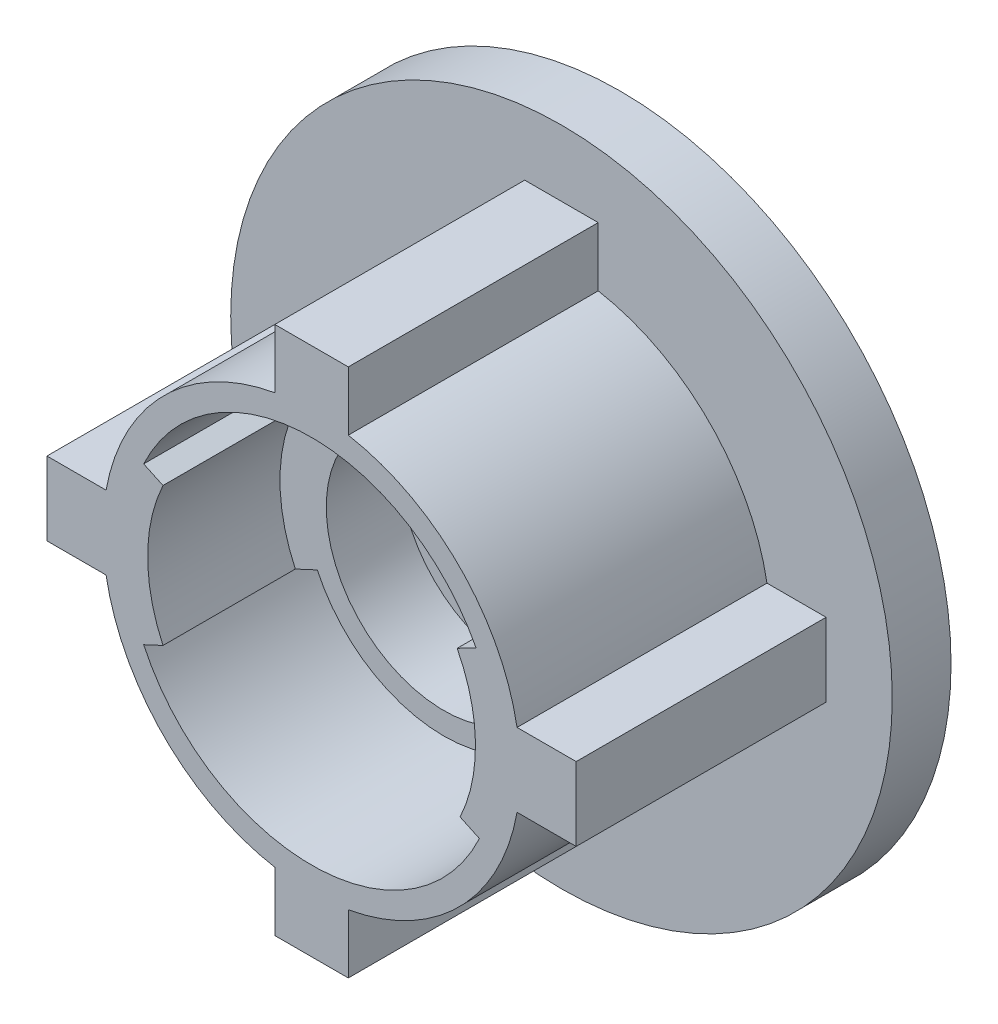
from build123d import *
from build123d.topology import SkipClean

# Parameters (mm, degrees)
ESBO_O1_R                 = 11.15
RESSALTO_EXTRUS_O1_DEPTH  = 15
ESBO_O2_R                 = 22.5
RESSALTO_EXTRUS_O2_DEPTH  = 4
RESSALTO_EXTRUS_O6_START  = -8
ESBO_O5_R                 = 11.15
ESBO_O5_R_2               = 8
RESSALTO_EXTRUS_O6_DEPTH  = 8
RESSALTO_EXTRUS_O7_START  = 4
ESBO_O7_R                 = 14.2
ESBO_O7_R_2               = 11.15
RESSALTO_EXTRUS_O7_DEPTH  = 4
RESSALTO_EXTRUS_O8_START  = 4
ESBO_O8_R                 = 11.15
ESBO_O8_R_2               = 8
RESSALTO_EXTRUS_O8_DEPTH  = 4
CORTE_EXTRUS_O1_DEPTH     = 7
CORTE_EXTRUS_O2_DEPTH     = 8
CORTE_EXTRUS_O3_START     = -4
CORTE_EXTRUS_O3_DEPTH     = 4
CORTE_EXTRUS_O4_START     = -11
CORTE_EXTRUS_O4_DEPTH     = 11
CORTE_EXTRUS_O5_START     = -3
ESBO_O17_R                = 11.15
CORTE_EXTRUS_O5_DEPTH     = 3
RESSALTO_EXTRUS_O11_DEPTH = 6


with BuildPart() as part:
    # Esboço1 → Ressalto-extrusão1 (new body)
    with BuildSketch(Plane.XY):
        with BuildLine():
            Line((-2.5, 18), (-2.5, 13.978197309))
            ThreePointArc((-2.5, 13.978197309), (-10.040916293, 10.040916293), (-13.978197309, 2.5))
            Line((-13.978197309, 2.5), (-18, 2.5))
            Line((-18, 2.5), (-18, -2.5))
            Line((-18, -2.5), (-13.978197309, -2.5))
            ThreePointArc((-13.978197309, -2.5), (-10.040916293, -10.040916293), (-2.5, -13.978197309))
            Line((-2.5, -13.978197309), (-2.5, -18))
            Line((-2.5, -18), (2.5, -18))
            Line((2.5, -18), (2.5, -13.978197309))
            ThreePointArc((2.5, -13.978197309), (10.040916293, -10.040916293), (13.978197309, -2.5))
            Line((13.978197309, -2.5), (18, -2.5))
            Line((18, -2.5), (18, 2.5))
            Line((18, 2.5), (13.978197309, 2.5))
            ThreePointArc((13.978197309, 2.5), (10.040916293, 10.040916293), (2.5, 13.978197309))
            Line((2.5, 13.978197309), (2.5, 18))
            Line((2.5, 18), (-2.5, 18))
        make_face()
        Circle(ESBO_O1_R, mode=Mode.SUBTRACT)
    extrude(amount=RESSALTO_EXTRUS_O1_DEPTH)

    # Esboço5 → Ressalto-extrusão6 (add)
    with BuildSketch(Plane.XY.offset(15).offset(RESSALTO_EXTRUS_O6_START)):
        Circle(ESBO_O5_R)
        Circle(ESBO_O5_R_2, mode=Mode.SUBTRACT)
    extrude(amount=RESSALTO_EXTRUS_O6_DEPTH)



with BuildPart() as body_2:
    # Esboço2 → Ressalto-extrusão2 (new body)
    # profile 1 of 5: a face of its own
    with SkipClean():  # the faces are left unmerged after this step: merging them gives an invalid solid
        with BuildSketch(Plane(origin=(0, 0, 0), x_dir=(-1, 0, 0), z_dir=(0, 0, -1))):
            Circle(ESBO_O2_R)
            with BuildLine():
                Line((2.5, 13.978197309), (2.5, 18))
                Line((2.5, 18), (-2.5, 18))
                Line((-2.5, 18), (-2.5, 13.978197309))
                ThreePointArc((-2.5, 13.978197309), (-10.040916293, 10.040916293), (-13.978197309, 2.5))
                Line((-13.978197309, 2.5), (-18, 2.5))
                Line((-18, 2.5), (-18, -2.5))
                Line((-18, -2.5), (-13.978197309, -2.5))
                ThreePointArc((-13.978197309, -2.5), (-10.040916293, -10.040916293), (-2.5, -13.978197309))
                Line((-2.5, -13.978197309), (-2.5, -18))
                Line((-2.5, -18), (2.5, -18))
                Line((2.5, -18), (2.5, -13.978197309))
                ThreePointArc((2.5, -13.978197309), (10.040916293, -10.040916293), (13.978197309, -2.5))
                Line((13.978197309, -2.5), (18, -2.5))
                Line((18, -2.5), (18, 2.5))
                Line((18, 2.5), (13.978197309, 2.5))
                ThreePointArc((13.978197309, 2.5), (10.040916293, 10.040916293), (2.5, 13.978197309))
            make_face(mode=Mode.SUBTRACT)
        # profile 2 of 5: a face of its own
        with BuildSketch(Plane(origin=(0, 0, 0), x_dir=(-1, 0, 0), z_dir=(0, 0, -1))):
            with BuildLine():
                Line((2.5, -18), (2.5, -13.978197309))
                ThreePointArc((2.5, -13.978197309), (0, -14.2), (-2.5, -13.978197309))
                Line((-2.5, -13.978197309), (-2.5, -18))
                Line((-2.5, -18), (2.5, -18))
            make_face()
        # profile 3 of 5: a face of its own
        with BuildSketch(Plane(origin=(0, 0, 0), x_dir=(-1, 0, 0), z_dir=(0, 0, -1))):
            with BuildLine():
                ThreePointArc((-13.978197309, -2.5), (-14.2, 0), (-13.978197309, 2.5))
                Line((-13.978197309, 2.5), (-18, 2.5))
                Line((-18, 2.5), (-18, -2.5))
                Line((-18, -2.5), (-13.978197309, -2.5))
            make_face()
        # profile 4 of 5: a face of its own
        with BuildSketch(Plane(origin=(0, 0, 0), x_dir=(-1, 0, 0), z_dir=(0, 0, -1))):
            with BuildLine():
                ThreePointArc((-2.5, 13.978197309), (0, 14.2), (2.5, 13.978197309))
                Line((2.5, 13.978197309), (2.5, 18))
                Line((2.5, 18), (-2.5, 18))
                Line((-2.5, 18), (-2.5, 13.978197309))
            make_face()
        # profile 5 of 5: a face of its own
        with BuildSketch(Plane(origin=(0, 0, 0), x_dir=(-1, 0, 0), z_dir=(0, 0, -1))):
            with BuildLine():
                Line((18, 2.5), (13.978197309, 2.5))
                ThreePointArc((13.978197309, 2.5), (14.2, 0), (13.978197309, -2.5))
                Line((13.978197309, -2.5), (18, -2.5))
                Line((18, -2.5), (18, 2.5))
            make_face()
        extrude(amount=RESSALTO_EXTRUS_O2_DEPTH)


with BuildPart() as part_1:
    with SkipClean():  # the faces are left unmerged after this step: merging them gives an invalid solid
        add(part.part)

        add(body_2.part)  # Ressalto-extrusão7 merges body 2
        # Esboço7 → Ressalto-extrusão7 (add)
        with BuildSketch(Plane(origin=(0, 0, 0), x_dir=(-1, 0, 0), z_dir=(0, 0, -1)).offset(RESSALTO_EXTRUS_O7_START)):
            Circle(ESBO_O7_R)
            with Locations(Location((0, 0, 0), (0, 0, 180))):
                Circle(ESBO_O7_R_2, mode=Mode.SUBTRACT)
        extrude(amount=-RESSALTO_EXTRUS_O7_DEPTH)

    # Esboço8 → Ressalto-extrusão8 (add)
    with BuildSketch(Plane(origin=(0, 0, 7), x_dir=(-1, 0, 0), z_dir=(0, 0, -1)).offset(RESSALTO_EXTRUS_O8_START)):
        Circle(ESBO_O8_R)
        with Locations(Location((0, 0, 0), (0, 0, 180))):
            Circle(ESBO_O8_R_2, mode=Mode.SUBTRACT)
    extrude(amount=-RESSALTO_EXTRUS_O8_DEPTH)

    # Esboço11 → Corte-extrusão1 (cut)
    with BuildSketch(Plane.XY.offset(15)):
        with BuildLine():
            Line((-11.191152491, -5.789482353), (-8.437773704, -4.365085901))
            ThreePointArc((-8.437773704, -4.365085901), (0.195118203, -9.497996046), (8.609923977, -4.014873487))
            Line((8.609923977, -4.014873487), (11.419478117, -5.324990098))
            ThreePointArc((11.419478117, -5.324990098), (0.258788353, -12.597342124), (-11.191152491, -5.789482353))
        make_face()
        with BuildLine():
            Line((-11.419478117, 5.324990098), (-8.609923977, 4.014873487))
            ThreePointArc((-8.609923977, 4.014873487), (-0.195118203, 9.497996046), (8.437773704, 4.365085901))
            Line((8.437773704, 4.365085901), (11.191152491, 5.789482353))
            ThreePointArc((11.191152491, 5.789482353), (-0.258788353, 12.597342124), (-11.419478117, 5.324990098))
        make_face()
    extrude(amount=-CORTE_EXTRUS_O1_DEPTH, mode=Mode.SUBTRACT)

    # Esboço12 → Corte-extrusão2 (cut)
    with BuildSketch(Plane.XY.offset(8)):
        with BuildLine():
            Line((11.419478117, -5.324990098), (8.609923977, -4.014873487))
            ThreePointArc((8.609923977, -4.014873487), (0.195118203, -9.497996046), (-8.437773704, -4.365085901))
            Line((-8.437773704, -4.365085901), (-11.191152491, -5.789482353))
            ThreePointArc((-11.191152491, -5.789482353), (0.258788353, -12.597342124), (11.419478117, -5.324990098))
        make_face()
        with BuildLine():
            Line((-11.419478117, 5.324990098), (-8.609923977, 4.014873487))
            ThreePointArc((-8.609923977, 4.014873487), (-0.195118203, 9.497996046), (8.437773704, 4.365085901))
            Line((8.437773704, 4.365085901), (11.191152491, 5.789482353))
            ThreePointArc((11.191152491, 5.789482353), (-0.258788353, 12.597342124), (-11.419478117, 5.324990098))
        make_face()
    extrude(amount=-CORTE_EXTRUS_O2_DEPTH, mode=Mode.SUBTRACT)

    # Esboço13 → Corte-extrusão3 (cut)
    with BuildSketch(Plane.XY.offset(15).offset(CORTE_EXTRUS_O3_START)):
        with BuildLine():
            Line((-2.5, 18), (-2.5, 13.978197309))
            ThreePointArc((-2.5, 13.978197309), (-10.040916293, 10.040916293), (-13.978197309, 2.5))
            Line((-13.978197309, 2.5), (-18, 2.5))
            Line((-18, 2.5), (-18, -2.5))
            Line((-18, -2.5), (-13.978197309, -2.5))
            ThreePointArc((-13.978197309, -2.5), (-10.040916293, -10.040916293), (-2.5, -13.978197309))
            Line((-2.5, -13.978197309), (-2.5, -18))
            Line((-2.5, -18), (2.5, -18))
            Line((2.5, -18), (2.5, -13.978197309))
            ThreePointArc((2.5, -13.978197309), (10.040916293, -10.040916293), (13.978197309, -2.5))
            Line((13.978197309, -2.5), (18, -2.5))
            Line((18, -2.5), (18, 2.5))
            Line((18, 2.5), (13.978197309, 2.5))
            ThreePointArc((13.978197309, 2.5), (10.040916293, 10.040916293), (2.5, 13.978197309))
            Line((2.5, 13.978197309), (2.5, 18))
            Line((2.5, 18), (-2.5, 18))
        make_face()
    extrude(amount=CORTE_EXTRUS_O3_DEPTH, mode=Mode.SUBTRACT)

    # Esboço14 → Corte-extrusão4 (cut)
    with BuildSketch(Plane.XY.offset(11).offset(CORTE_EXTRUS_O4_START)):
        with BuildLine():
            Line((11.191152491, 5.789482353), (8.437773704, 4.365085901))
            ThreePointArc((8.437773704, 4.365085901), (-0.195118203, 9.497996046), (-8.609923977, 4.014873487))
            Line((-8.609923977, 4.014873487), (-11.419478117, 5.324990098))
            ThreePointArc((-11.419478117, 5.324990098), (-0.258788353, 12.597342124), (11.191152491, 5.789482353))
        make_face()
        with BuildLine():
            Line((-8.609923977, -4.014873487), (-11.419478117, -5.324990098))
            ThreePointArc((-11.419478117, -5.324990098), (-11.307700579, -5.55840873), (-11.191152491, -5.789482353))
            Line((-11.191152491, -5.789482353), (-8.437773704, -4.365085901))
            ThreePointArc((-8.437773704, -4.365085901), (-8.525647262, -4.190863725), (-8.609923977, -4.014873487))
        make_face()
    extrude(amount=CORTE_EXTRUS_O4_DEPTH, mode=Mode.SUBTRACT)

    # Esboço17 → Corte-extrusão5 (cut)
    with SkipClean():  # the faces are left unmerged after this step: merging them gives an invalid solid
        with BuildSketch(Plane.XY.offset(11).offset(CORTE_EXTRUS_O5_START)):
            with Locations(Location((0, 0, 0), (0, 0, 335))):
                Circle(ESBO_O17_R)
        extrude(amount=CORTE_EXTRUS_O5_DEPTH, mode=Mode.SUBTRACT)

    # Esboço18 → Ressalto-extrusão11 (add)
    with SkipClean():  # the faces are left unmerged after this step: merging them gives an invalid solid
        with BuildSketch(Plane.XY.offset(11)):
            with BuildLine():
                Line((2.5, 13.978197309), (2.5, 18))
                Line((2.5, 18), (-2.5, 18))
                Line((-2.5, 18), (-2.5, 13.978197309))
                ThreePointArc((-2.5, 13.978197309), (-10.040916293, 10.040916293), (-13.978197309, 2.5))
                Line((-13.978197309, 2.5), (-18, 2.5))
                Line((-18, 2.5), (-18, -2.5))
                Line((-18, -2.5), (-13.978197309, -2.5))
                ThreePointArc((-13.978197309, -2.5), (-10.040916293, -10.040916293), (-2.5, -13.978197309))
                Line((-2.5, -13.978197309), (-2.5, -18))
                Line((-2.5, -18), (2.5, -18))
                Line((2.5, -18), (2.5, -13.978197309))
                ThreePointArc((2.5, -13.978197309), (10.040916293, -10.040916293), (13.978197309, -2.5))
                Line((13.978197309, -2.5), (18, -2.5))
                Line((18, -2.5), (18, 2.5))
                Line((18, 2.5), (13.978197309, 2.5))
                ThreePointArc((13.978197309, 2.5), (10.040916293, 10.040916293), (2.5, 13.978197309))
            make_face()
            with BuildLine():
                Line((-11.419478117, -5.324990098), (-10.105331825, -4.712193618))
                ThreePointArc((-10.105331825, -4.712193618), (-11.15, 0), (-10.105331825, 4.712193618))
                Line((-10.105331825, 4.712193618), (-11.419478117, 5.324990098))
                ThreePointArc((-11.419478117, 5.324990098), (-0.258788353, 12.597342124), (11.191152491, 5.789482353))
                Line((11.191152491, 5.789482353), (9.903281768, 5.1232324))
                ThreePointArc((9.903281768, 5.1232324), (11.147647991, 0.229007154), (10.105331825, -4.712193618))
                Line((10.105331825, -4.712193618), (11.419478117, -5.324990098))
                ThreePointArc((11.419478117, -5.324990098), (0, -12.6), (-11.419478117, -5.324990098))
            make_face(mode=Mode.SUBTRACT)
        extrude(amount=RESSALTO_EXTRUS_O11_DEPTH)


solid = part_1.part
